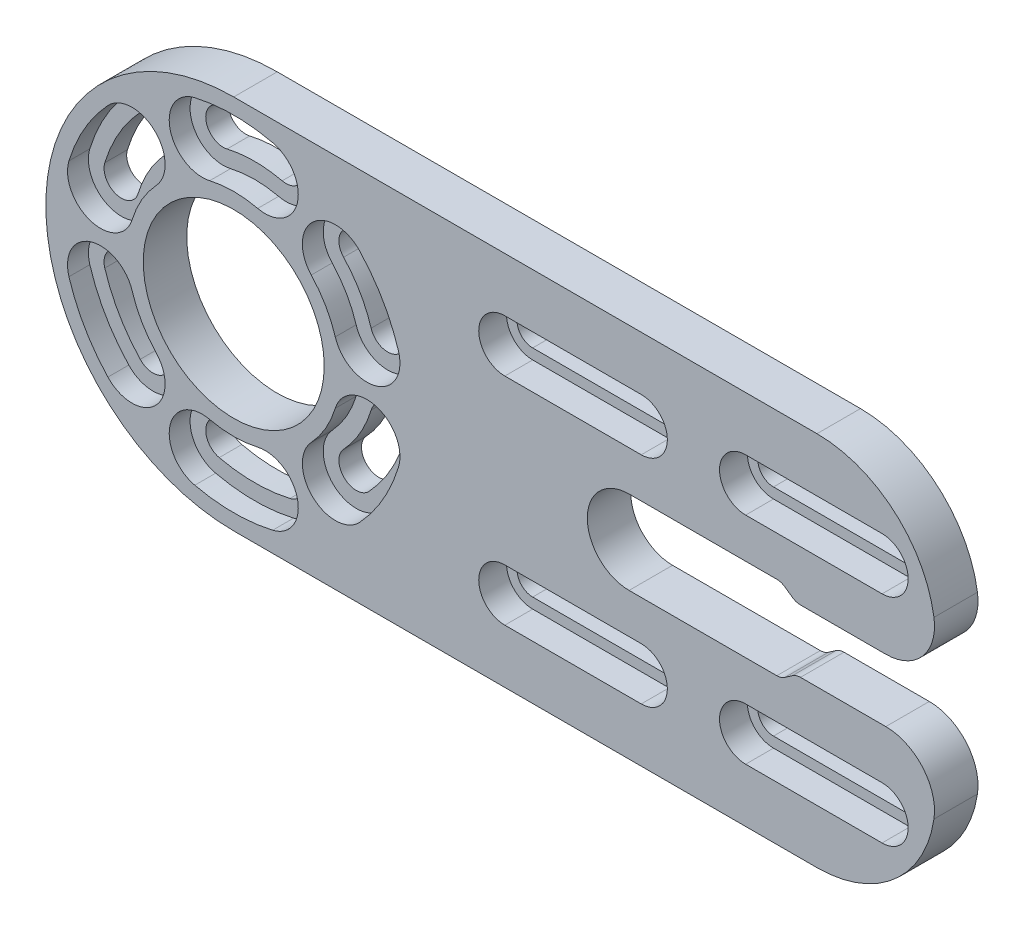
from build123d import *

# Parameters (mm, degrees)
BOSS_EXTRUDE1_DEPTH = 6.25
SKETCH2_R           = 13
CUT_EXTRUDE1_DEPTH  = 75.264880664
CUT_EXTRUDE2_DEPTH  = 3
CUT_EXTRUDE3_DEPTH  = 75.0727514
FILLET1_R           = 7
CUT_EXTRUDE4_DEPTH  = 4
CUT_EXTRUDE5_DEPTH  = 75.109446226


with BuildPart() as part:
    # Sketch1 → Boss-Extrude1 (new body)
    with BuildSketch(Plane.XY):
        with BuildLine():
            Line((-41.9, 27), (41.9, 27))
            ThreePointArc((41.9, 27), (53.92081528, 22.02081528), (58.9, 10))
            Line((58.9, 10), (58.9, -10))
            ThreePointArc((58.9, -10), (53.92081528, -22.02081528), (41.9, -27))
            Line((41.9, -27), (-41.9, -27))
            ThreePointArc((-41.9, -27), (-68.9, 0), (-41.9, 27))
        make_face()
    extrude(amount=BOSS_EXTRUDE1_DEPTH)

    # Sketch2 → Cut-Extrude1 (cut, through all)
    with BuildSketch(Plane.XY.offset(6.25)):
        with BuildLine():
            ThreePointArc((14.9, -6), (19.142640687, -4.242640687), (20.9, 0))
            Line((20.9, 0), (8.9, 0))
            ThreePointArc((8.9, 0), (10.657359313, -4.242640687), (14.9, -6))
        make_face()
        with BuildLine():
            Line((8.9, 0), (20.9, 0))
            ThreePointArc((20.9, 0), (19.142640687, 4.242640687), (14.9, 6))
            ThreePointArc((14.9, 6), (10.657359313, 4.242640687), (8.9, 0))
        make_face()
        with BuildLine():
            Line((58.9, 0), (20.9, 0))
            ThreePointArc((20.9, 0), (19.142640687, -4.242640687), (14.9, -6))
            Line((14.9, -6), (36.127180412, -6))
            ThreePointArc((36.127180412, -6), (36.728592011, -5.907433901), (37.274333285, -5.638304089))
            Line((37.274333285, -5.638304089), (38.383444705, -4.861695911))
            ThreePointArc((38.383444705, -4.861695911), (38.929185979, -4.592566099), (39.530597578, -4.5))
            Line((39.530597578, -4.5), (58.9, -4.5))
            Line((58.9, -4.5), (58.9, 0))
        make_face()
        with BuildLine():
            ThreePointArc((14.9, 6), (19.142640687, 4.242640687), (20.9, 0))
            Line((20.9, 0), (58.9, 0))
            Line((58.9, 0), (58.9, 4.5))
            Line((58.9, 4.5), (39.530597578, 4.5))
            ThreePointArc((39.530597578, 4.5), (38.929185979, 4.592566099), (38.383444705, 4.861695911))
            Line((38.383444705, 4.861695911), (37.274333285, 5.638304089))
            ThreePointArc((37.274333285, 5.638304089), (36.728592011, 5.907433901), (36.127180412, 6))
            Line((36.127180412, 6), (14.9, 6))
        make_face()
        with Locations((-41.9, 0)):
            Circle(SKETCH2_R)
    extrude(amount=-CUT_EXTRUDE1_DEPTH, mode=Mode.SUBTRACT)

    # Sketch3 → Cut-Extrude2 (cut)
    with BuildSketch(Plane.XY.offset(6.25)):
        with BuildLine():
            ThreePointArc((-36.304183663, 24.109113205), (-41.9, 24.75), (-47.495816337, 24.109113205))
            ThreePointArc((-47.495816337, 24.109113205), (-51.048873311, 18.408167131), (-45.347927238, 14.855110157))
            ThreePointArc((-45.347927238, 14.855110157), (-41.9, 15.25), (-38.452072762, 14.855110157))
            ThreePointArc((-38.452072762, 14.855110157), (-32.751126689, 18.408167131), (-36.304183663, 24.109113205))
        make_face()
        with BuildLine():
            ThreePointArc((-18.222987334, 7.2084375), (-20.465871256, 12.375), (-23.81880367, 16.900675705))
            ThreePointArc((-23.81880367, 16.900675705), (-30.532496283, 17.127240269), (-30.759060847, 10.413547657))
            ThreePointArc((-30.759060847, 10.413547657), (-28.693112592, 7.625), (-27.31113361, 4.4415625))
            ThreePointArc((-27.31113361, 4.4415625), (-21.383622972, 1.280926862), (-18.222987334, 7.2084375))
        make_face()
        with BuildLine():
            ThreePointArc((-23.81880367, -16.900675705), (-20.465871256, -12.375), (-18.222987334, -7.2084375))
            ThreePointArc((-18.222987334, -7.2084375), (-21.383622972, -1.280926862), (-27.31113361, -4.4415625))
            ThreePointArc((-27.31113361, -4.4415625), (-28.693112592, -7.625), (-30.759060847, -10.413547657))
            ThreePointArc((-30.759060847, -10.413547657), (-30.532496283, -17.127240269), (-23.81880367, -16.900675705))
        make_face()
        with BuildLine():
            ThreePointArc((-47.495816337, -24.109113205), (-41.9, -24.75), (-36.304183663, -24.109113205))
            ThreePointArc((-36.304183663, -24.109113205), (-32.751126689, -18.408167131), (-38.452072762, -14.855110157))
            ThreePointArc((-38.452072762, -14.855110157), (-41.9, -15.25), (-45.347927238, -14.855110157))
            ThreePointArc((-45.347927238, -14.855110157), (-51.048873311, -18.408167131), (-47.495816337, -24.109113205))
        make_face()
        with BuildLine():
            ThreePointArc((-65.577012666, -7.2084375), (-63.334128744, -12.375), (-59.98119633, -16.900675705))
            ThreePointArc((-59.98119633, -16.900675705), (-53.267503717, -17.127240269), (-53.040939153, -10.413547657))
            ThreePointArc((-53.040939153, -10.413547657), (-55.106887408, -7.625), (-56.48886639, -4.4415625))
            ThreePointArc((-56.48886639, -4.4415625), (-62.416377028, -1.280926862), (-65.577012666, -7.2084375))
        make_face()
        with BuildLine():
            ThreePointArc((-59.98119633, 16.900675705), (-63.334128744, 12.375), (-65.577012666, 7.2084375))
            ThreePointArc((-65.577012666, 7.2084375), (-62.416377028, 1.280926862), (-56.48886639, 4.4415625))
            ThreePointArc((-56.48886639, 4.4415625), (-55.106887408, 7.625), (-53.040939153, 10.413547657))
            ThreePointArc((-53.040939153, 10.413547657), (-53.267503717, 17.127240269), (-59.98119633, 16.900675705))
        make_face()
    extrude(amount=-CUT_EXTRUDE2_DEPTH, mode=Mode.SUBTRACT)

    # Sketch4 → Cut-Extrude3 (cut, through all)
    with BuildSketch(Plane.XY.offset(3.25)):
        with BuildLine():
            ThreePointArc((-25.462548791, 15.364250641), (-28.996071219, 15.483495148), (-29.115315726, 11.949972721))
            ThreePointArc((-29.115315726, 11.949972721), (-26.744555434, 8.75), (-25.158677913, 5.096875))
            ThreePointArc((-25.158677913, 5.096875), (-22.038935472, 3.433382559), (-20.37544303, 6.553125))
            ThreePointArc((-20.37544303, 6.553125), (-22.414428415, 11.25), (-25.462548791, 15.364250641))
        make_face()
        with BuildLine():
            ThreePointArc((-37.943362186, 17.046847721), (-34.942864253, 18.916877707), (-36.812894239, 21.917375641))
            ThreePointArc((-36.812894239, 21.917375641), (-41.9, 22.5), (-46.987105761, 21.917375641))
            ThreePointArc((-46.987105761, 21.917375641), (-48.857135747, 18.916877707), (-45.856637814, 17.046847721))
            ThreePointArc((-45.856637814, 17.046847721), (-41.9, 17.5), (-37.943362186, 17.046847721))
        make_face()
        with BuildLine():
            ThreePointArc((-20.37544303, -6.553125), (-22.038935472, -3.433382559), (-25.158677913, -5.096875))
            ThreePointArc((-25.158677913, -5.096875), (-26.744555434, -8.75), (-29.115315726, -11.949972721))
            ThreePointArc((-29.115315726, -11.949972721), (-28.996071219, -15.483495148), (-25.462548791, -15.364250641))
            ThreePointArc((-25.462548791, -15.364250641), (-22.414428415, -11.25), (-20.37544303, -6.553125))
        make_face()
        with BuildLine():
            ThreePointArc((-36.812894239, -21.917375641), (-34.942864253, -18.916877707), (-37.943362186, -17.046847721))
            ThreePointArc((-37.943362186, -17.046847721), (-41.9, -17.5), (-45.856637814, -17.046847721))
            ThreePointArc((-45.856637814, -17.046847721), (-48.857135747, -18.916877707), (-46.987105761, -21.917375641))
            ThreePointArc((-46.987105761, -21.917375641), (-41.9, -22.5), (-36.812894239, -21.917375641))
        make_face()
        with BuildLine():
            ThreePointArc((-58.337451209, -15.364250641), (-54.803928781, -15.483495148), (-54.684684274, -11.949972721))
            ThreePointArc((-54.684684274, -11.949972721), (-57.055444566, -8.75), (-58.641322087, -5.096875))
            ThreePointArc((-58.641322087, -5.096875), (-61.761064528, -3.433382559), (-63.42455697, -6.553125))
            ThreePointArc((-63.42455697, -6.553125), (-61.385571585, -11.25), (-58.337451209, -15.364250641))
        make_face()
        with BuildLine():
            ThreePointArc((-63.42455697, 6.553125), (-61.761064528, 3.433382559), (-58.641322087, 5.096875))
            ThreePointArc((-58.641322087, 5.096875), (-57.055444566, 8.75), (-54.684684274, 11.949972721))
            ThreePointArc((-54.684684274, 11.949972721), (-54.803928781, 15.483495148), (-58.337451209, 15.364250641))
            ThreePointArc((-58.337451209, 15.364250641), (-61.385571585, 11.25), (-63.42455697, 6.553125))
        make_face()
    extrude(amount=-CUT_EXTRUDE3_DEPTH, mode=Mode.SUBTRACT)

    # Fillet1
    fillet1_edges = [part.edges().sort_by_distance(p)[0] for p in [
        (58.9, -4.5, 3.125),
        (58.9, 4.5, 3.125),
    ]]
    fillet(fillet1_edges, radius=FILLET1_R)

    # Sketch5 → Cut-Extrude4 (cut)
    with BuildSketch(Plane.XY.offset(6.25)):
        with BuildLine():
            Line((-2.95, 19.25), (16.65, 19.25))
            ThreePointArc((16.65, 19.25), (20.4, 15.5), (16.65, 11.75))
            Line((16.65, 11.75), (-2.95, 11.75))
            ThreePointArc((-2.95, 11.75), (-6.7, 15.5), (-2.95, 19.25))
        make_face()
        with BuildLine():
            Line((51.25, 19.25), (31.65, 19.25))
            ThreePointArc((31.65, 19.25), (27.9, 15.5), (31.65, 11.75))
            Line((31.65, 11.75), (51.25, 11.75))
            ThreePointArc((51.25, 11.75), (55, 15.5), (51.25, 19.25))
        make_face()
        with BuildLine():
            Line((51.25, -19.25), (31.65, -19.25))
            ThreePointArc((31.65, -19.25), (27.9, -15.5), (31.65, -11.75))
            Line((31.65, -11.75), (51.25, -11.75))
            ThreePointArc((51.25, -11.75), (55, -15.5), (51.25, -19.25))
        make_face()
        with BuildLine():
            Line((-2.95, -19.25), (16.65, -19.25))
            ThreePointArc((16.65, -19.25), (20.4, -15.5), (16.65, -11.75))
            Line((16.65, -11.75), (-2.95, -11.75))
            ThreePointArc((-2.95, -11.75), (-6.7, -15.5), (-2.95, -19.25))
        make_face()
    extrude(amount=-CUT_EXTRUDE4_DEPTH, mode=Mode.SUBTRACT)

    # Sketch6 → Cut-Extrude5 (cut, through all)
    with BuildSketch(Plane.XY.offset(2.25)):
        with BuildLine():
            Line((-2.95, 17.75), (16.65, 17.75))
            ThreePointArc((16.65, 17.75), (18.9, 15.5), (16.65, 13.25))
            Line((16.65, 13.25), (-2.95, 13.25))
            ThreePointArc((-2.95, 13.25), (-5.2, 15.5), (-2.95, 17.75))
        make_face()
        with BuildLine():
            Line((31.65, 17.75), (51.25, 17.75))
            ThreePointArc((51.25, 17.75), (53.5, 15.5), (51.25, 13.25))
            Line((51.25, 13.25), (31.65, 13.25))
            ThreePointArc((31.65, 13.25), (29.4, 15.5), (31.65, 17.75))
        make_face()
        with BuildLine():
            Line((31.65, -17.75), (51.25, -17.75))
            ThreePointArc((51.25, -17.75), (53.5, -15.5), (51.25, -13.25))
            Line((51.25, -13.25), (31.65, -13.25))
            ThreePointArc((31.65, -13.25), (29.4, -15.5), (31.65, -17.75))
        make_face()
        with BuildLine():
            Line((-2.95, -17.75), (16.65, -17.75))
            ThreePointArc((16.65, -17.75), (18.9, -15.5), (16.65, -13.25))
            Line((16.65, -13.25), (-2.95, -13.25))
            ThreePointArc((-2.95, -13.25), (-5.2, -15.5), (-2.95, -17.75))
        make_face()
    extrude(amount=-CUT_EXTRUDE5_DEPTH, mode=Mode.SUBTRACT)


solid = part.part
